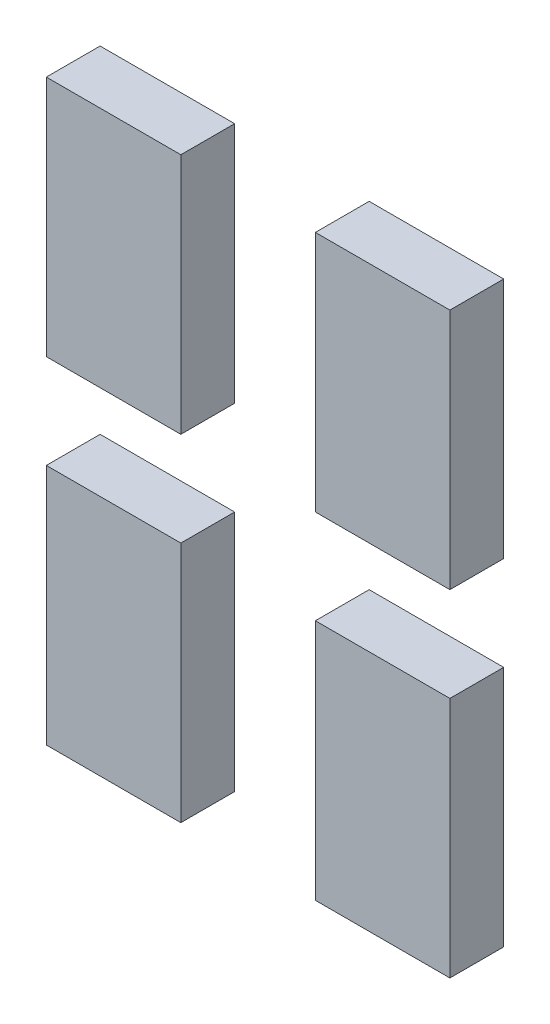
from build123d import *

# Parameters (mm, degrees)
SKETCH_1_W        = 2
SKETCH_1_H        = 3.6
EXTRUDE_1_DEPTH   = 0.8
EXTRUDE_1_2_DEPTH = 0.8
EXTRUDE_1_3_DEPTH = 0.8
EXTRUDE_1_4_DEPTH = 0.8


with BuildPart() as part:
    # Эскиз1 → Бобышка-Вытянуть1 (new body)
    with BuildSketch(Plane.XY):
        with Locations((4, 0)):
            Rectangle(SKETCH_1_W, SKETCH_1_H)
    extrude(amount=EXTRUDE_1_DEPTH)


with BuildPart() as body_2:
    # Эскиз1 → Extrude 1 2 (new body)
    with BuildSketch(Plane.XY):
        Rectangle(SKETCH_1_W, SKETCH_1_H)
    extrude(amount=EXTRUDE_1_2_DEPTH)


with BuildPart() as body_3:
    # Эскиз1 → Extrude 1 3 (new body)
    with BuildSketch(Plane.XY):
        with Locations((4, 5)):
            Rectangle(SKETCH_1_W, SKETCH_1_H)
    extrude(amount=EXTRUDE_1_3_DEPTH)


with BuildPart() as body_4:
    # Эскиз1 → Extrude 1 4 (new body)
    with BuildSketch(Plane.XY):
        with Locations((0, 5)):
            Rectangle(SKETCH_1_W, SKETCH_1_H)
    extrude(amount=EXTRUDE_1_4_DEPTH)


solid = Compound([part.part, body_2.part, body_3.part, body_4.part])
